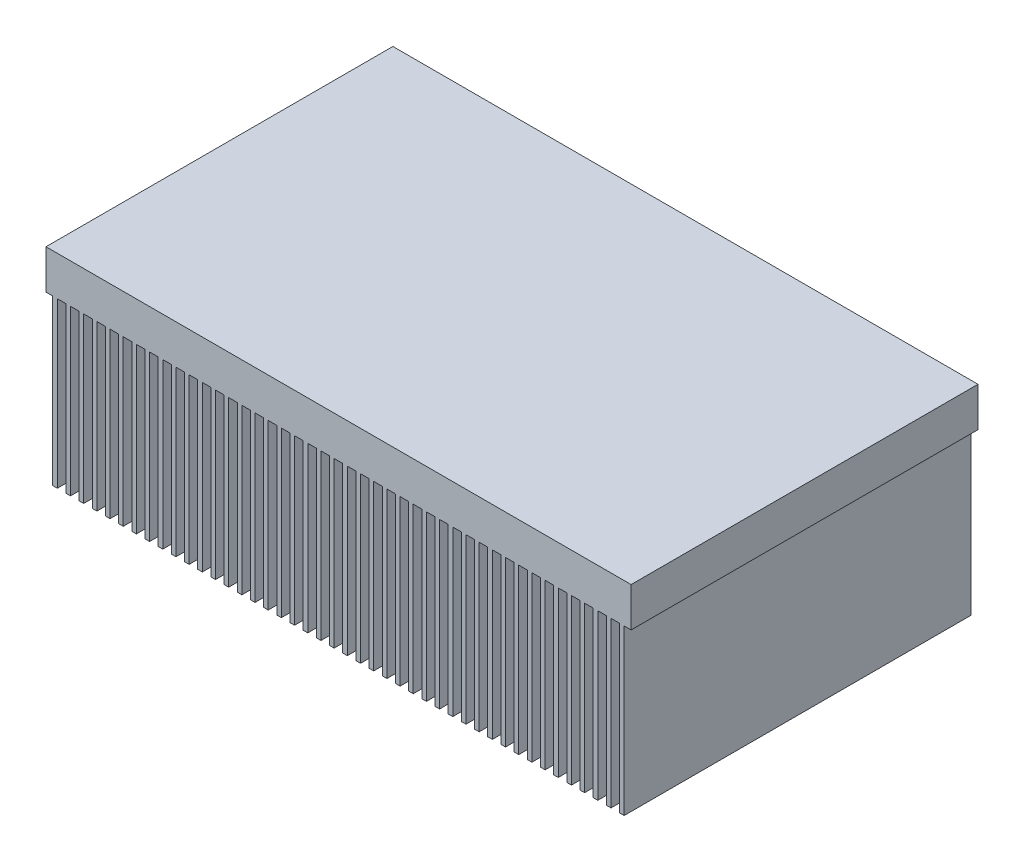
from build123d import *

# Parameters (mm, degrees)
SKETCH_1_W      = 253
SKETCH_1_H      = 17
SKETCH_1_W_2    = 2
SKETCH_1_H_2    = 71
EXTRUDE_1_DEPTH = 150


with BuildPart() as part:
    # 草图1 → 凸台-拉伸1 (new body)
    with BuildSketch(Plane.XY):
        with Locations((126.5, -8.5)):
            Rectangle(SKETCH_1_W, SKETCH_1_H)
        with Locations((3.9, -52.5)):
            Rectangle(SKETCH_1_W_2, SKETCH_1_H_2)
        with Locations((9.6, -52.5)):
            Rectangle(SKETCH_1_W_2, SKETCH_1_H_2)
        with Locations((15.3, -52.5)):
            Rectangle(SKETCH_1_W_2, SKETCH_1_H_2)
        with Locations((21, -52.5)):
            Rectangle(SKETCH_1_W_2, SKETCH_1_H_2)
        with Locations((26.7, -52.5)):
            Rectangle(SKETCH_1_W_2, SKETCH_1_H_2)
        with Locations((32.4, -52.5)):
            Rectangle(SKETCH_1_W_2, SKETCH_1_H_2)
        with Locations((38.1, -52.5)):
            Rectangle(SKETCH_1_W_2, SKETCH_1_H_2)
        with Locations((43.8, -52.5)):
            Rectangle(SKETCH_1_W_2, SKETCH_1_H_2)
        with Locations((49.5, -52.5)):
            Rectangle(SKETCH_1_W_2, SKETCH_1_H_2)
        with Locations((55.2, -52.5)):
            Rectangle(SKETCH_1_W_2, SKETCH_1_H_2)
        with Locations((60.9, -52.5)):
            Rectangle(SKETCH_1_W_2, SKETCH_1_H_2)
        with Locations((66.6, -52.5)):
            Rectangle(SKETCH_1_W_2, SKETCH_1_H_2)
        with Locations((72.3, -52.5)):
            Rectangle(SKETCH_1_W_2, SKETCH_1_H_2)
        with Locations((78, -52.5)):
            Rectangle(SKETCH_1_W_2, SKETCH_1_H_2)
        with Locations((83.7, -52.5)):
            Rectangle(SKETCH_1_W_2, SKETCH_1_H_2)
        with Locations((89.4, -52.5)):
            Rectangle(SKETCH_1_W_2, SKETCH_1_H_2)
        with Locations((95.1, -52.5)):
            Rectangle(SKETCH_1_W_2, SKETCH_1_H_2)
        with Locations((100.8, -52.5)):
            Rectangle(SKETCH_1_W_2, SKETCH_1_H_2)
        with Locations((106.5, -52.5)):
            Rectangle(SKETCH_1_W_2, SKETCH_1_H_2)
        with Locations((112.2, -52.5)):
            Rectangle(SKETCH_1_W_2, SKETCH_1_H_2)
        with Locations((117.9, -52.5)):
            Rectangle(SKETCH_1_W_2, SKETCH_1_H_2)
        with Locations((123.6, -52.5)):
            Rectangle(SKETCH_1_W_2, SKETCH_1_H_2)
        with Locations((129.3, -52.5)):
            Rectangle(SKETCH_1_W_2, SKETCH_1_H_2)
        with Locations((135, -52.5)):
            Rectangle(SKETCH_1_W_2, SKETCH_1_H_2)
        with Locations((140.7, -52.5)):
            Rectangle(SKETCH_1_W_2, SKETCH_1_H_2)
        with Locations((146.4, -52.5)):
            Rectangle(SKETCH_1_W_2, SKETCH_1_H_2)
        with Locations((152.1, -52.5)):
            Rectangle(SKETCH_1_W_2, SKETCH_1_H_2)
        with Locations((157.8, -52.5)):
            Rectangle(SKETCH_1_W_2, SKETCH_1_H_2)
        with Locations((163.5, -52.5)):
            Rectangle(SKETCH_1_W_2, SKETCH_1_H_2)
        with Locations((169.2, -52.5)):
            Rectangle(SKETCH_1_W_2, SKETCH_1_H_2)
        with Locations((174.9, -52.5)):
            Rectangle(SKETCH_1_W_2, SKETCH_1_H_2)
        with Locations((180.6, -52.5)):
            Rectangle(SKETCH_1_W_2, SKETCH_1_H_2)
        with Locations((186.3, -52.5)):
            Rectangle(SKETCH_1_W_2, SKETCH_1_H_2)
        with Locations((192, -52.5)):
            Rectangle(SKETCH_1_W_2, SKETCH_1_H_2)
        with Locations((197.7, -52.5)):
            Rectangle(SKETCH_1_W_2, SKETCH_1_H_2)
        with Locations((203.4, -52.5)):
            Rectangle(SKETCH_1_W_2, SKETCH_1_H_2)
        with Locations((209.1, -52.5)):
            Rectangle(SKETCH_1_W_2, SKETCH_1_H_2)
        with Locations((214.8, -52.5)):
            Rectangle(SKETCH_1_W_2, SKETCH_1_H_2)
        with Locations((220.5, -52.5)):
            Rectangle(SKETCH_1_W_2, SKETCH_1_H_2)
        with Locations((226.2, -52.5)):
            Rectangle(SKETCH_1_W_2, SKETCH_1_H_2)
        with Locations((231.9, -52.5)):
            Rectangle(SKETCH_1_W_2, SKETCH_1_H_2)
        with Locations((237.6, -52.5)):
            Rectangle(SKETCH_1_W_2, SKETCH_1_H_2)
        with Locations((243.3, -52.5)):
            Rectangle(SKETCH_1_W_2, SKETCH_1_H_2)
        with Locations((249, -52.5)):
            Rectangle(SKETCH_1_W_2, SKETCH_1_H_2)
    extrude(amount=EXTRUDE_1_DEPTH)


solid = part.part
